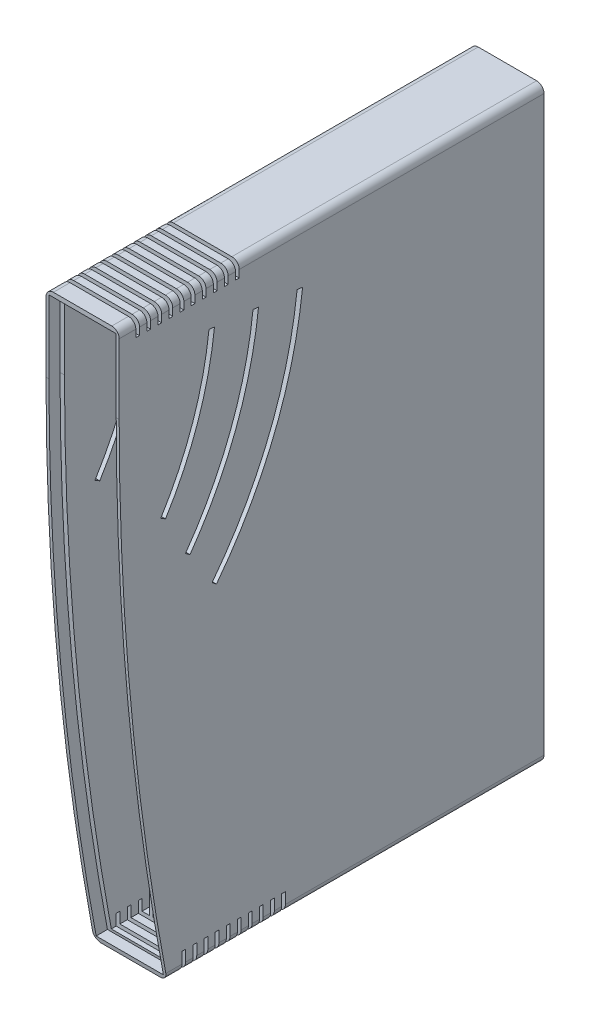
from build123d import *

# Parameters (mm, degrees)
SKETCH1_W               = 19.81
SKETCH1_H               = 159.1
BOSS_EXTRUDE1_DEPTH     = 115
SHELL1_T                = -2
CUT_EXTRUDE1_DEPTH      = 142.229028886
CUT_EXTRUDE1_DEPTH_BACK = 142.229028886
FILLET1_R               = 2
SKETCH3_W               = 21
SKETCH3_H               = 1
CUT_EXTRUDE2_DEPTH      = 4
LPATTERN1_COUNT         = 10
LPATTERN1_PITCH         = 3
SKETCH8_W               = 27.700077209
SKETCH8_H               = 1
CUT_EXTRUDE4_DEPTH      = 5
LPATTERN2_COUNT         = 10
LPATTERN2_PITCH         = 3
CUT_EXTRUDE3_DEPTH      = 142.229029037
SKETCH7_W               = 1
SKETCH7_H               = 6.5
BOSS_EXTRUDE3_DEPTH     = 90
CHAMFER2_SIZE           = 0.5
CUT_EXTRUDE6_DEPTH      = 9.105
SKETCH11_W              = 1
SKETCH11_H              = 6.5
BOSS_EXTRUDE6_DEPTH     = 89


with BuildPart() as part:
    # Sketch1 → Boss-Extrude1 (new body)
    with BuildSketch(Plane.XY):
        Rectangle(SKETCH1_W, SKETCH1_H)
    extrude(amount=BOSS_EXTRUDE1_DEPTH)

    # Shell1
    shell1_openings = [part.faces().sort_by_distance(p)[0] for p in [
        (0, 0, 115),
    ]]
    offset(amount=SHELL1_T, openings=shell1_openings, kind=Kind.INTERSECTION)

    # Sketch2 → Cut-Extrude1 (cut, two sides: drawn at the far end of the back side and taken through both)
    with BuildSketch(Plane(origin=(9.905, 0, 0), x_dir=(0, 0, -1), z_dir=(1, 0, 0)).offset(-CUT_EXTRUDE1_DEPTH_BACK)):
        with BuildLine():
            Line((-115, 482.170987722), (-115, 79.55))
            Line((-115, 79.55), (-115, 58.65))
            ThreePointArc((-115, 58.65), (-111.742842211, -10.755043044), (-102, -79.55))
            Line((-102, -79.55), (-26.918013628, -475.108282781))
            Line((-26.918013628, -475.108282781), (-828.772746701, -548.88921573))
            Line((-828.772746701, -548.88921573), (-916.854733073, 408.390054773))
            Line((-916.854733073, 408.390054773), (-115, 482.170987722))
        make_face()
    extrude(amount=CUT_EXTRUDE1_DEPTH + CUT_EXTRUDE1_DEPTH_BACK, mode=Mode.SUBTRACT)

    # Fillet1
    fillet1_edges = [part.edges().sort_by_distance(p)[0] for p in [
        (9.905, -79.55, 51),
        (-9.905, -79.55, 51),
        (-9.905, 79.55, 57.5),
        (9.905, 79.55, 57.5),
    ]]
    fillet(fillet1_edges, radius=FILLET1_R)

    # Sketch3 → Cut-Extrude2 (cut)
    with BuildSketch(Plane(origin=(0, 79.55, 0), x_dir=(1, 0, 0), z_dir=(0, 1, 0))):
        with Locations((0, -110)):
            Rectangle(SKETCH3_W, SKETCH3_H)
    cut_extrude2 = extrude(amount=-CUT_EXTRUDE2_DEPTH, mode=Mode.SUBTRACT)

    # LPattern1: Cut-Extrude2 ×10
    with Locations(*[(0, 0, -i * LPATTERN1_PITCH) for i in range(1, LPATTERN1_COUNT)]):
        add(cut_extrude2, mode=Mode.SUBTRACT)

    # Sketch8 → Cut-Extrude4 (cut)
    with BuildSketch(Plane.XZ.offset(79.55)):
        with Locations((0.524208986, 97.5)):
            Rectangle(SKETCH8_W, SKETCH8_H)
    cut_extrude4 = extrude(amount=-CUT_EXTRUDE4_DEPTH, mode=Mode.SUBTRACT)

    # LPattern2: Cut-Extrude4 ×10
    with Locations(*[(0, 0, -i * LPATTERN2_PITCH) for i in range(1, LPATTERN2_COUNT)]):
        add(cut_extrude4, mode=Mode.SUBTRACT)

    # Sketch5 → Cut-Extrude3 (cut, through all)
    with BuildSketch(Plane.ZY.offset(9.905)):
        with BuildLine():
            Line((65.347036406, 64.823533738), (66.838155653, 64.986516539))
            ThreePointArc((66.838155653, 64.986516539), (74.40797048, 34.807641847), (89.855449244, 7.799458383))
            Line((89.855449244, 7.799458383), (88.667189124, 6.88401429))
            ThreePointArc((88.667189124, 6.88401429), (73.01645406, 34.24756859), (65.347036406, 64.823533738))
        make_face()
        with BuildLine():
            Line((77.275990376, 66.127396149), (78.767109622, 66.29037895))
            ThreePointArc((78.767109622, 66.29037895), (84.83196797, 41.097147113), (97.049571899, 18.245197712))
            Line((97.049571899, 18.245197712), (95.827312392, 17.375668128))
            ThreePointArc((95.827312392, 17.375668128), (83.430037817, 40.563675608), (77.275990376, 66.127396149))
        make_face()
        with BuildLine():
            Line((89.204944346, 67.431258559), (90.696063592, 67.594241361))
            ThreePointArc((90.696063592, 67.594241361), (95.094328846, 47.99151385), (103.7314578, 29.852835107))
            Line((103.7314578, 29.852835107), (102.457595124, 29.060828868))
            ThreePointArc((102.457595124, 29.060828868), (93.67651402, 47.501818923), (89.204944346, 67.431258559))
        make_face()
    extrude(amount=-CUT_EXTRUDE3_DEPTH, mode=Mode.SUBTRACT)

    # Sketch7 → Boss-Extrude3 (add)
    with BuildSketch(Plane.XY.offset(95)):
        with Locations((-5.405, 74.3)):
            Rectangle(SKETCH7_W, SKETCH7_H)
        with Locations((-2.605, 74.3)):
            Rectangle(SKETCH7_W, SKETCH7_H)
    extrude(amount=-BOSS_EXTRUDE3_DEPTH)

    # Chamfer2
    chamfer2_edges = [part.edges().sort_by_distance(p)[0] for p in [
        (-3.105, 74.3, 95),
        (-4.905, 74.3, 95),
    ]]
    chamfer(chamfer2_edges, length=CHAMFER2_SIZE)

    # Sketch10 → Cut-Extrude6 (cut, symmetric)
    with BuildSketch(Plane(origin=(0, 0, 0), x_dir=(0, 0, -1), z_dir=(1, 0, 0))):
        with BuildLine():
            Line((-131.709183252, 78.35), (-112, 78.35))
            Line((-112, 78.35), (-112, 58.65))
            ThreePointArc((-112, 58.65), (-108.78648369, -10.149542881), (-99.173917094, -78.35))
            Line((-99.173917094, -78.35), (-102.923842912, -78.35))
            Line((-102.923842912, -78.35), (-131.709183252, 78.35))
        make_face()
    extrude(amount=CUT_EXTRUDE6_DEPTH, both=True, mode=Mode.SUBTRACT)

    # Sketch11 → Boss-Extrude6 (add)
    with BuildSketch(Plane.XY.offset(2)):
        with Locations((-5.405, -74.3)):
            Rectangle(SKETCH11_W, SKETCH11_H)
        with Locations((-2.605, -74.3)):
            Rectangle(SKETCH11_W, SKETCH11_H)
    extrude(amount=BOSS_EXTRUDE6_DEPTH)


solid = part.part
